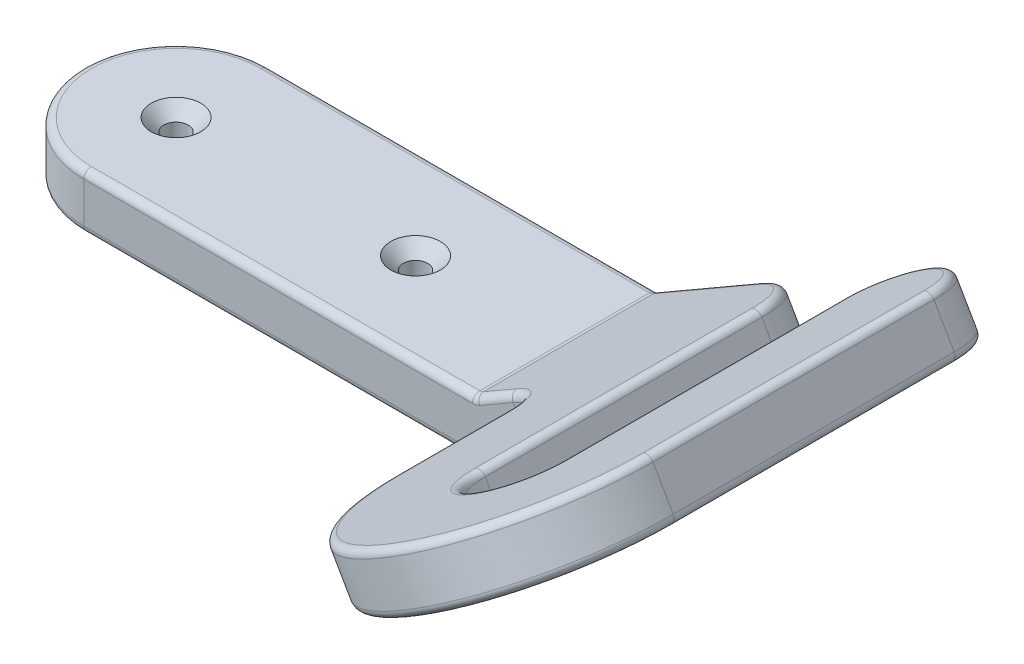
from build123d import *

# Parameters (mm, degrees)
BOSS_EXTRUDE1_DEPTH                             = 15
BOSS_EXTRUDE2_DEPTH                             = 50
BOSS_EXTRUDE3_DEPTH                             = 15
CSK_FOR_M5_FLAT_HEAD_MACHINE_SCREW1_D           = 6.6
CSK_FOR_M5_FLAT_HEAD_MACHINE_SCREW1_CSINK_D     = 13.44
CSK_FOR_M5_FLAT_HEAD_MACHINE_SCREW1_CSINK_ANGLE = 90
FILLET1_R                                       = 17
FILLET2_R                                       = 2


with BuildPart() as part:
    # Sketch1 → Boss-Extrude1 (new body)
    with BuildSketch(Plane(origin=(0, 0, 0), x_dir=(1, 0, 0), z_dir=(0, 1, 0))):
        with BuildLine():
            Line((-55, 25), (55, 25))
            Line((55, 25), (55, -25))
            Line((55, -25), (-55, -25))
            ThreePointArc((-55, -25), (-80, 0), (-55, 25))
        make_face()
    extrude(amount=BOSS_EXTRUDE1_DEPTH)

    # Sketch2 → Boss-Extrude2 (add)
    with BuildSketch(Plane(origin=(0, 0, -25), x_dir=(-1, 0, 0), z_dir=(0, 0, -1))):
        Polygon((-76.650635095, 12.5), (-55, 0), (-50.980762114, 15), (-69.150635095, 25.490381057), align=None)
    extrude(amount=-BOSS_EXTRUDE2_DEPTH)

    # Sketch3 → Boss-Extrude3 (add)
    with BuildSketch(Plane(origin=(13.75, -23.815698604, 0), x_dir=(0.8660254037844378, 0.5000000000000017, 0), z_dir=(0.5000000000000016, -0.8660254037844377, 0))):
        with BuildLine():
            Line((100.131397208, 65), (100.131397208, -10))
            ThreePointArc((100.131397208, -10), (95.737998926, -20.606601718), (85.131397208, -25))
            Line((85.131397208, -25), (62.631397208, -25))
            Line((62.631397208, -25), (62.631397208, 25))
            ThreePointArc((62.631397208, 25), (69.70246502, 27.928932188), (72.631397208, 35))
            Line((72.631397208, 35), (72.631397208, 65))
            ThreePointArc((72.631397208, 65), (112.631397208, 105), (152.631397208, 65))
            Line((152.631397208, 65), (152.631397208, -11.25))
            ThreePointArc((152.631397208, -11.25), (138.881397208, -25), (125.131397208, -11.25))
            Line((125.131397208, -11.25), (125.131397208, 65))
            ThreePointArc((125.131397208, 65), (112.631397208, 77.5), (100.131397208, 65))
        make_face()
    extrude(amount=-BOSS_EXTRUDE3_DEPTH)

    # CSK for M5 Flat Head Machine Screw1 (through all)
    with Locations(Plane(origin=(0, 15, 0), x_dir=(1, 0, 0), z_dir=(0, 1, 0))):
        with Locations((-55, 0), (10, 0)):
            CounterSinkHole(CSK_FOR_M5_FLAT_HEAD_MACHINE_SCREW1_D / 2, CSK_FOR_M5_FLAT_HEAD_MACHINE_SCREW1_CSINK_D / 2, counter_sink_angle=CSK_FOR_M5_FLAT_HEAD_MACHINE_SCREW1_CSINK_ANGLE)

    # Fillet1
    fillet1_edges = [part.edges().sort_by_distance(p)[0] for p in [
        (55, 0, 0),
    ]]
    fillet(fillet1_edges, radius=FILLET1_R)

    # Fillet2
    fillet2_edges = [part.edges().sort_by_distance(p)[0] for p in [
        (-80, 15, 0),
        (-2.009618943, 15, -25),
        (-2.009618943, 15, 25),
        (65.478357378, 23.370190528, -25),
        (73.210408185, 10.513784068, -25),
        (50.980762114, 15, 0),
        (55.735571585, 17.745190528, 25),
        (74.114105414, 11.035533906, 27.928932188),
        (96.661539177, 24.053300859, -20.606601718),
        (100.466333699, 26.25, 27.5),
        (111.291651246, 32.5, 77.5),
        (122.116968793, 38.75, 26.875),
        (134.024818095, 45.625, -25),
        (145.932667397, 52.5, 26.875),
        (111.291651246, 32.5, 105),
        (76.650635095, 12.5, 50),
        (89.161539177, 37.043681916, -20.606601718),
        (66.614105414, 24.025914963, 27.928932188),
        (69.150635095, 25.490381057, 50),
        (103.791651246, 45.490381057, 105),
        (138.432667397, 65.490381057, 26.875),
        (126.524818095, 58.615381057, -25),
        (114.616968793, 51.740381057, 26.875),
        (103.791651246, 45.490381057, 77.5),
        (92.966333699, 39.240381057, 27.5),
        (-2.277568136, 0, 25),
        (-80, 0, 0),
        (63.467622393, 4.888784068, 25),
        (-2.277568136, 0, -25),
        (54.844787495, 0.579260953, -25),
        (54.844787495, 0.579260953, 25),
    ]]
    fillet(fillet2_edges, radius=FILLET2_R)


solid = part.part
